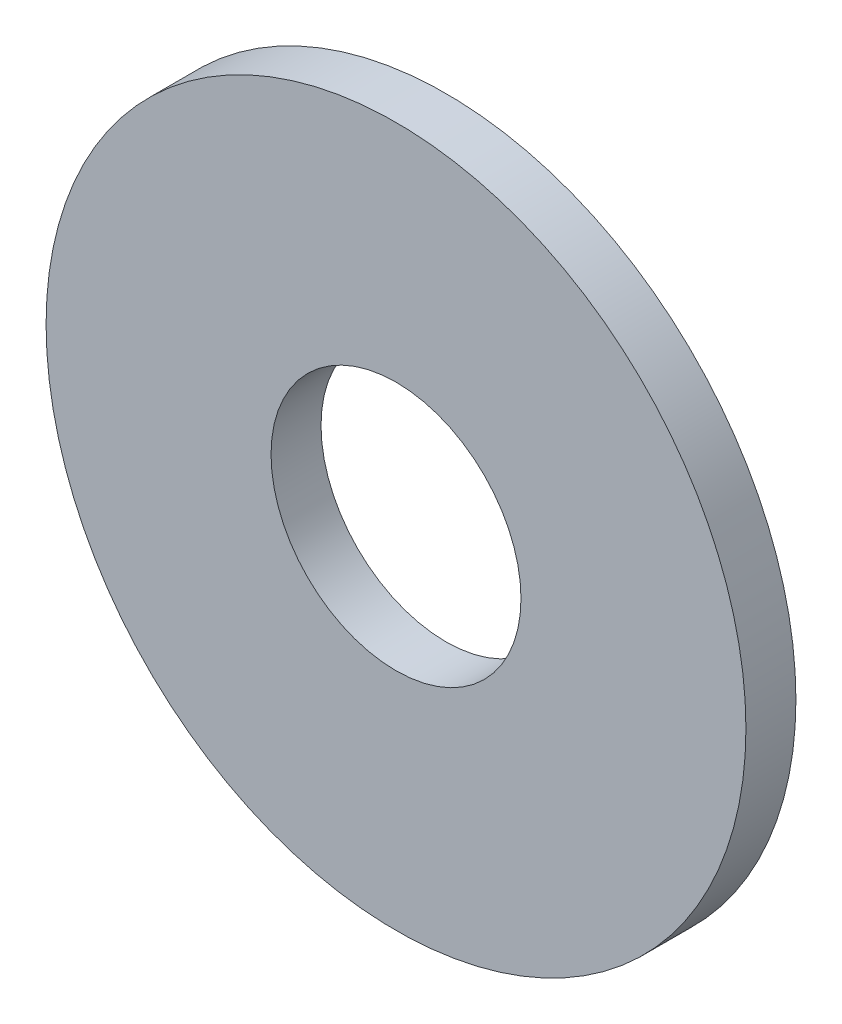
from build123d import *

# Parameters (mm, degrees)
ESBO_O1_R                = 7
ESBO_O1_R_2              = 2.5
RESSALTO_EXTRUS_O1_DEPTH = 1


with BuildPart() as part:
    # Esboço1 → Ressalto-extrusão1 (new body)
    with BuildSketch(Plane.XY):
        Circle(ESBO_O1_R)
        Circle(ESBO_O1_R_2, mode=Mode.SUBTRACT)
    extrude(amount=RESSALTO_EXTRUS_O1_DEPTH)


solid = part.part
